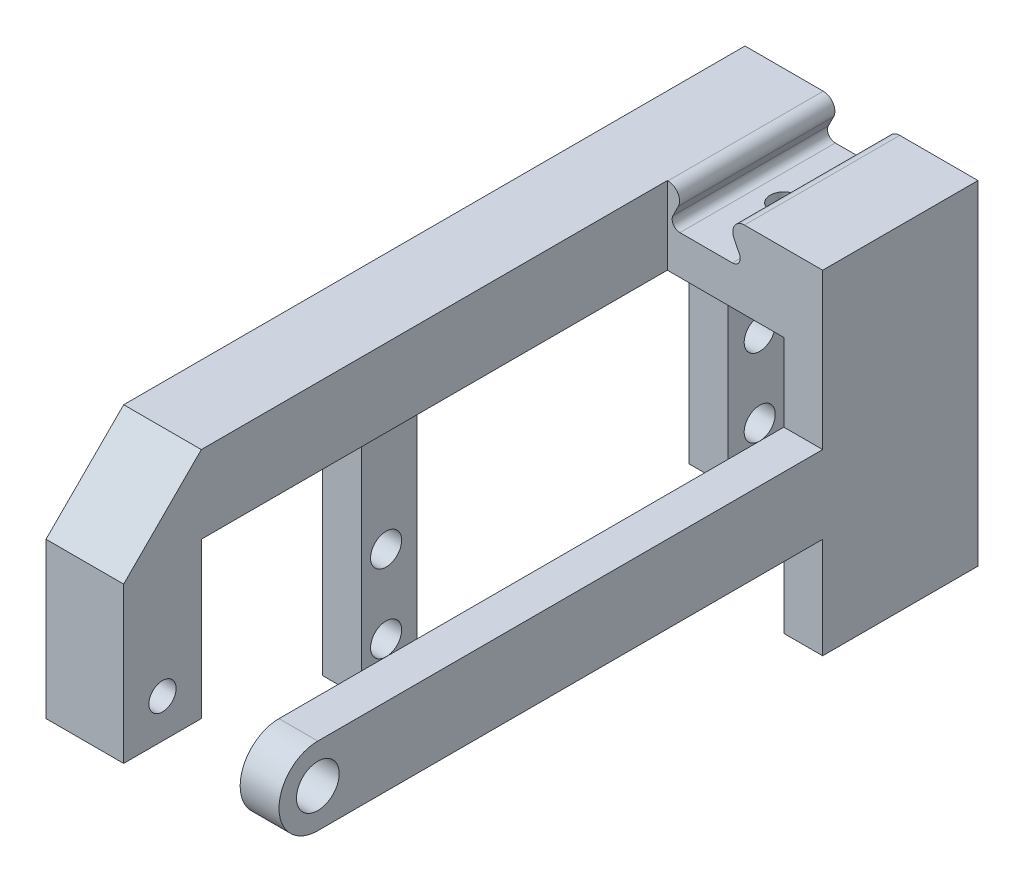
from build123d import *

# Parameters (mm, degrees)
RESSALTO_EXTRUS_O1_DEPTH = 80
ESBO_O2_W                = 40
ESBO_O2_H                = 33
ESBO_O2_W_2              = 25.6
CORTE_EXTRUS_O1_DEPTH    = 12
ESBO_O4_R                = 2
CORTE_EXTRUS_O3_DEPTH    = 12
ESBO_O6_W                = 10
ESBO_O6_H                = 20
RESSALTO_EXTRUS_O2_DEPTH = 10
ESBO_O7_R                = 1.75
CORTE_EXTRUS_O4_DEPTH    = 15
CORTE_EXTRUS_O5_DEPTH    = 5
ESBO_O10_R               = 5
ESBO_O10_R_2             = 2.75
RESSALTO_EXTRUS_O3_DEPTH = 5
ESBO_O11_W               = 20
ESBO_O11_H               = 20
ESBO_O11_W_2             = 25
ESBO_O11_H_2             = 10
CORTE_EXTRUS_O7_DEPTH    = 60
ESBO_O13_W               = 30
ESBO_O13_H               = 47
CORTE_EXTRUS_O9_DEPTH    = 168
FILETE1_R                = 1.5
ESBO_O14_R               = 1.75
CORTE_EXTRUS_O10_DEPTH   = 14.5
CORTE_EXTRUS_O11_DEPTH   = 2.5
FILETE2_R                = 1


with BuildPart() as part:
    # Esboço1 → Ressalto-extrusão1 (new body)
    with BuildSketch(Plane.XY):
        Polygon((-2.5, 45), (-15, 45), (-15, 2), (-10, 2), (-10, 35), (10, 35), (10, -35), (-15, -35), (-15, -45), (15, -45), (15, 45), (2.5, 45), (5, 40), (-5, 40), align=None)
    extrude(amount=RESSALTO_EXTRUS_O1_DEPTH)

    # Esboço2 → Corte-extrusão1 (cut)
    with BuildSketch(Plane.ZY.offset(15)):
        with Locations((27.2, 18.5)):
            Rectangle(ESBO_O2_W, ESBO_O2_H)
        with Locations((67.2, 18.5)):
            Rectangle(ESBO_O2_W_2, ESBO_O2_H)
    extrude(amount=-CORTE_EXTRUS_O1_DEPTH, mode=Mode.SUBTRACT)

    # Esboço4 → Corte-extrusão3 (cut)
    with BuildSketch(Plane(origin=(-10, 0, 0), x_dir=(0, 0, -1), z_dir=(1, 0, 0))):
        with Locations(Location((-3.104223841, 17.002484575, 0), (0, 0, 90))):
            Circle(ESBO_O4_R)
        with Locations(Location((-3.104223841, 7.000828192, 0), (0, 0, 90))):
            Circle(ESBO_O4_R)
        with Locations(Location((-51.210481376, 17.002484575, 0), (0, 0, 90))):
            Circle(ESBO_O4_R)
        with Locations(Location((-51.210481376, 7.000828192, 0), (0, 0, 90))):
            Circle(ESBO_O4_R)
    extrude(amount=-CORTE_EXTRUS_O3_DEPTH, mode=Mode.SUBTRACT)

    # Esboço6 → Ressalto-extrusão2 (add)
    with BuildSketch(Plane.ZY.offset(15)):
        with Locations((85, 25)):
            Rectangle(ESBO_O6_W, ESBO_O6_H)
        Polygon((80, 35), (90, 35), (80, 45), align=None)
    extrude(amount=-RESSALTO_EXTRUS_O2_DEPTH)

    # Esboço7 → Corte-extrusão4 (cut)
    with BuildSketch(Plane.ZY.offset(15)):
        with Locations(Location((85, 20, 0), (0, 0, 270))):
            Circle(ESBO_O7_R)
    extrude(amount=-CORTE_EXTRUS_O4_DEPTH, mode=Mode.SUBTRACT)

    # Esboço8 → Corte-extrusão5 (cut)
    with BuildSketch(Plane.ZY.offset(15)):
        Polygon((85, 23.75277675), (81.75, 21.876388375), (81.75, 18.123611625), (85, 16.24722325), (88.25, 18.123611625), (88.25, 21.876388375), align=None)
    extrude(amount=-CORTE_EXTRUS_O5_DEPTH, mode=Mode.SUBTRACT)

    # Esboço10 → Ressalto-extrusão3 (add)
    # profile 1 of 3: a face of its own
    with BuildSketch(Plane(origin=(15, 0, 0), x_dir=(0, 0, -1), z_dir=(1, 0, 0))):
        with BuildLine():
            Line((-80, 25), (-85, 25))
            ThreePointArc((-85, 25), (-81.464466094, 23.535533906), (-80, 20))
            Line((-80, 20), (-80, 25))
        make_face()
    # profile 2 of 3: a face of its own
    with BuildSketch(Plane(origin=(15, 0, 0), x_dir=(0, 0, -1), z_dir=(1, 0, 0))):
        with Locations((-85, 20)):
            Circle(ESBO_O10_R)
        with Locations(Location((-85, 20, 0), (0, 0, 90))):
            Circle(ESBO_O10_R_2, mode=Mode.SUBTRACT)
    # profile 3 of 3: a face of its own
    with BuildSketch(Plane(origin=(15, 0, 0), x_dir=(0, 0, -1), z_dir=(1, 0, 0))):
        with BuildLine():
            Line((-80, 15), (-80, 20))
            ThreePointArc((-80, 20), (-81.464466094, 16.464466094), (-85, 15))
            Line((-85, 15), (-80, 15))
        make_face()
    extrude(amount=-RESSALTO_EXTRUS_O3_DEPTH)

    # Esboço11 → Corte-extrusão7 (cut)
    with BuildSketch(Plane.XY.offset(80)):
        with Locations((5, 35)):
            Rectangle(ESBO_O11_W, ESBO_O11_H)
        Polygon((10, -45), (15, -45), (15, 15), (10, 15), (10, -35), align=None)
        with Locations((-2.5, -40)):
            Rectangle(ESBO_O11_W_2, ESBO_O11_H_2)
    extrude(amount=-CORTE_EXTRUS_O7_DEPTH, mode=Mode.SUBTRACT)

    # Esboço13 → Corte-extrusão9 (cut)
    with BuildSketch(Plane.XY.offset(20)):
        with Locations((0, -21.5)):
            Rectangle(ESBO_O13_W, ESBO_O13_H)
    extrude(amount=-CORTE_EXTRUS_O9_DEPTH, mode=Mode.SUBTRACT)

    # Filete1
    filete1_edges = [part.edges().sort_by_distance(p)[0] for p in [
        (2.5, 45, 10),
        (-2.5, 45, 10),
    ]]
    fillet(filete1_edges, radius=FILETE1_R)

    # Esboço14 → Corte-extrusão10 (cut)
    with BuildSketch(Plane(origin=(0, 40, 0), x_dir=(1, 0, 0), z_dir=(0, 1, 0))):
        with Locations(Location((0, -10, 0), (0, 0, 270))):
            Circle(ESBO_O14_R)
    extrude(amount=-CORTE_EXTRUS_O10_DEPTH, mode=Mode.SUBTRACT)

    # Esboço15 → Corte-extrusão11 (cut)
    with BuildSketch(Plane.XZ.offset(-35)):
        Polygon((0, 13.75277675), (-3.25, 11.876388375), (-3.25, 8.123611625), (0, 6.24722325), (3.25, 8.123611625), (3.25, 11.876388375), align=None)
    extrude(amount=-CORTE_EXTRUS_O11_DEPTH, mode=Mode.SUBTRACT)

    # Filete2
    filete2_edges = [part.edges().sort_by_distance(p)[0] for p in [
        (-5, 40, 10),
        (5, 40, 10),
    ]]
    fillet(filete2_edges, radius=FILETE2_R)


solid = part.part
